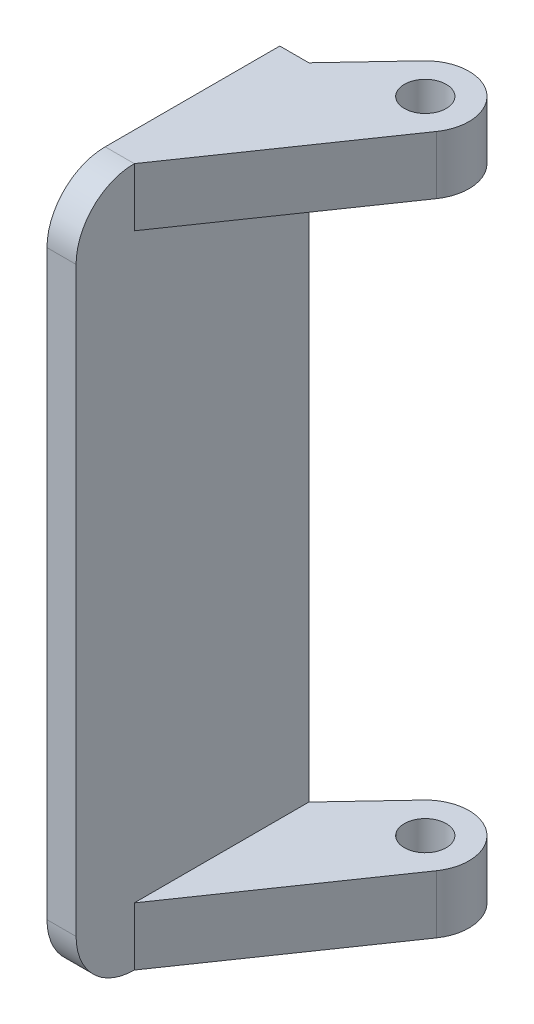
from build123d import *

# Parameters (mm, degrees)
BOSS_EXTRUDE1_DEPTH     = 38.1
CUT_EXTRUDE1_DEPTH      = 31.75
CUT_EXTRUDE1_DEPTH_BACK = 31.75
FILLET1_R               = 6.35
SKETCH3_R               = 2.286
CUT_EXTRUDE2_DEPTH      = 83.366623246


with BuildPart() as part:
    # Sketch1 → Boss-Extrude1 (new, symmetric)
    with BuildSketch(Plane(origin=(0, 0, 0), x_dir=(1, 0, 0), z_dir=(0, 1, 0))):
        with BuildLine():
            Line((-12.7, -3.175), (-12.7, -28.575))
            Line((-12.7, -28.575), (-9.525, -28.575))
            Line((-9.525, -28.575), (-9.525, -22.225))
            Line((-9.525, -22.225), (3.922177061, -2.70146874))
            ThreePointArc((3.922177061, -2.70146874), (2.990880149, 3.706216694), (-3.468948889, 3.263096667))
            Line((-3.468948889, 3.263096667), (-9.525, -3.175))
            Line((-9.525, -3.175), (-12.7, -3.175))
        make_face()
    extrude(amount=BOSS_EXTRUDE1_DEPTH, both=True)

    # Sketch2 → Cut-Extrude1 (cut, two sides: drawn at the far end of the back side and taken through both)
    with BuildSketch(Plane(origin=(0, 0, 0), x_dir=(1, 0, 0), z_dir=(0, 1, 0)).offset(-CUT_EXTRUDE1_DEPTH_BACK)):
        with BuildLine():
            Line((-3.468948889, 3.263096667), (-9.525, -3.175))
            Line((-9.525, -3.175), (-9.525, -22.225))
            Line((-9.525, -22.225), (3.922177061, -2.70146874))
            ThreePointArc((3.922177061, -2.70146874), (2.990880149, 3.706216694), (-3.468948889, 3.263096667))
        make_face()
    extrude(amount=CUT_EXTRUDE1_DEPTH + CUT_EXTRUDE1_DEPTH_BACK, mode=Mode.SUBTRACT)

    # Fillet1
    fillet1_edges = [part.edges().sort_by_distance(p)[0] for p in [
        (-11.1125, -38.1, 28.575),
        (-11.1125, 38.1, 28.575),
    ]]
    fillet(fillet1_edges, radius=FILLET1_R)

    # Sketch3 → Cut-Extrude2 (cut, through all)
    with BuildSketch(Plane(origin=(0, 38.1, 0), x_dir=(1, 0, 0), z_dir=(0, 1, 0))):
        with Locations(Location((0, 0, 0), (0, 0, 270))):
            Circle(SKETCH3_R)
    extrude(amount=-CUT_EXTRUDE2_DEPTH, mode=Mode.SUBTRACT)


solid = part.part
